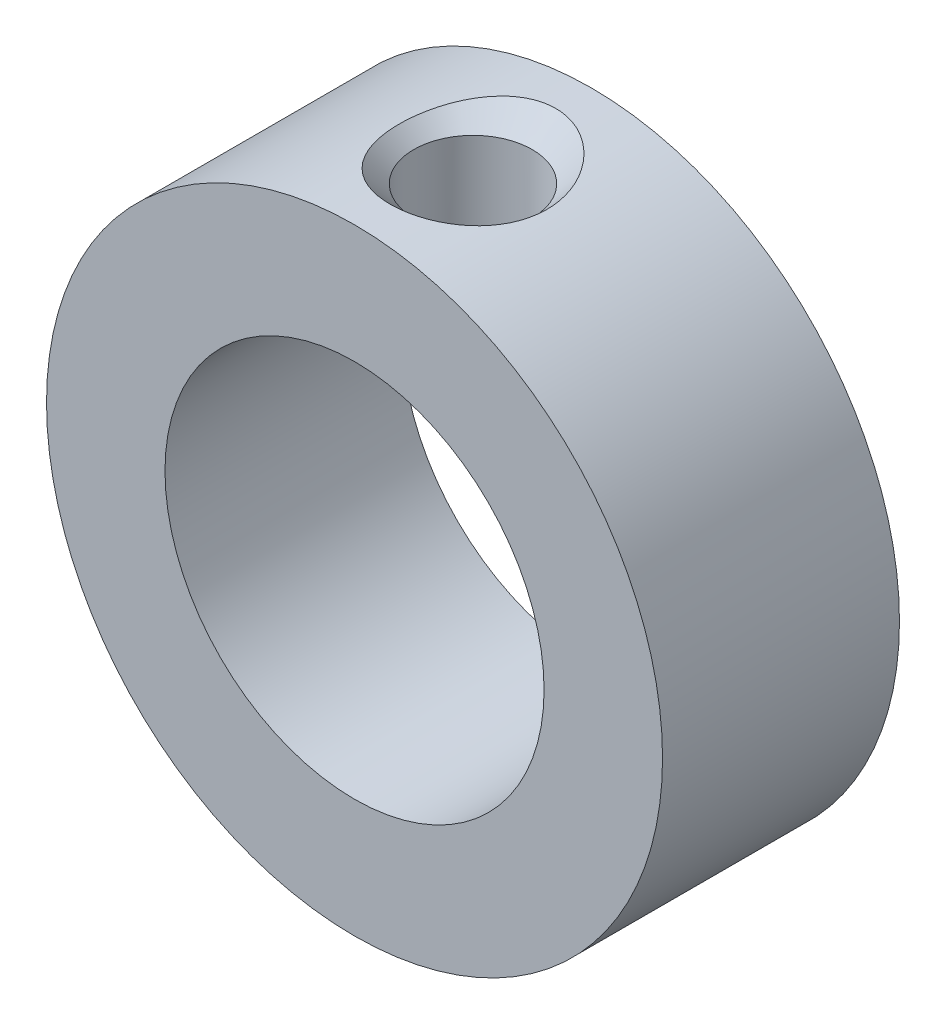
from build123d import *

# Parameters (mm, degrees)
SKETCH1_R           = 20.6375
SKETCH1_R_2         = 12.7
BOSS_EXTRUDE1_DEPTH = 7.9375


with BuildPart() as part:
    # Sketch1 → Boss-Extrude1 (new, symmetric)
    with BuildSketch(Plane.XY):
        Circle(SKETCH1_R)
        Circle(SKETCH1_R_2, mode=Mode.SUBTRACT)
    extrude(amount=BOSS_EXTRUDE1_DEPTH, both=True)

    # Sketch3 → Cut-Revolve1 (revolve, cut)
    with BuildSketch(Plane.XY, mode=Mode.PRIVATE) as cut_revolve1_sk:
        Polygon((0, 0), (0, 24.879055942), (-9.797805942, 24.879055942), (-3.96875, 19.05), (-3.96875, 0), align=None)
    revolve(cut_revolve1_sk.sketch.rotate(Axis((0, 0, 0), (0, 1, 0)), 300.156831564), axis=Axis((0, 0, 0), (0, 1, 0)), mode=Mode.SUBTRACT)


solid = part.part
